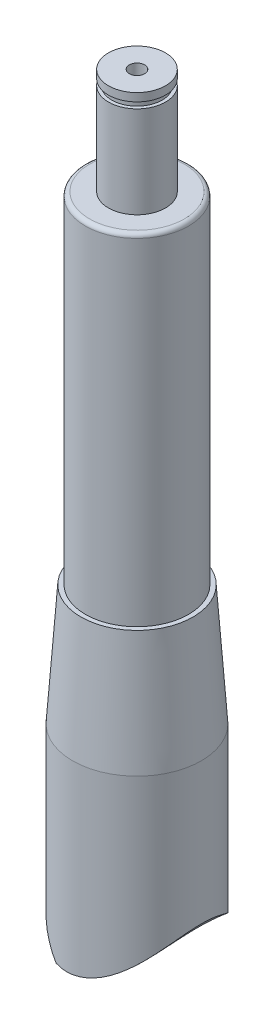
from build123d import *

# Parameters (mm, degrees)
FILLET1_R               = 1
CUT_EXTRUDE1_DEPTH      = 184.811724327
CUT_EXTRUDE1_DEPTH_BACK = 184.811724327
CUT_EXTRUDE2_DEPTH      = 183.746332302
CUT_EXTRUDE2_DEPTH_BACK = 180
SKETCH3_R               = 1.85
CUT_EXTRUDE3_DEPTH      = 184.811724344
CUT_EXTRUDE3_DEPTH_BACK = 184.811724344
SKETCH4_R               = 16


with BuildPart() as part:
    # Sketch1 → Revolve2 (revolve)
    with BuildSketch(Plane.XY):
        Polygon((0, 0), (15.5, 0), (15.5, 46), (13.5, 75), (12.425, 75), (12.425, 157), (6.875, 157), (6.875, 179.1), (6.070935316, 179.1), (6.070935316, 180.55), (6.870935316, 180.55), (6.870935316, 182.5), (0, 182.5), align=None)
    revolve(axis=Axis((0, 263.878189578, 0), (0, -1, 0)))

    # Fillet1
    fillet1_edges = [part.edges().sort_by_distance(p)[0] for p in [
        (-12.425, 157, 0),
    ]]
    fillet(fillet1_edges, radius=FILLET1_R)

    # Sketch2 → Cut-Extrude1 (cut, two sides: drawn at the far end of the back side and taken through both)
    with BuildSketch(Plane.XY.offset(-CUT_EXTRUDE1_DEPTH_BACK)):
        with BuildLine():
            Line((-15.5, 3), (-19.676433944, 0))
            Line((-19.676433944, 0), (9.520360954, -11.635719705))
            Line((9.520360954, -11.635719705), (20.15271979, -0.609569802))
            Line((20.15271979, -0.609569802), (15.5, 12))
            add(Edge.make_bspline(
                [(15.5, 12), (5.345045333, -3.515489974), (-15.5, 3)],
                knots=[0, 0, 0, 1, 1, 1], degree=2))
        make_face()
    extrude(amount=CUT_EXTRUDE1_DEPTH + CUT_EXTRUDE1_DEPTH_BACK, mode=Mode.SUBTRACT)

    # Sketch3 → Cut-Extrude2 (cut, two sides: drawn at the far end of the back side and taken through both)
    with BuildSketch(Plane(origin=(0, 182.5, 0), x_dir=(1, 0, 0), z_dir=(0, 1, 0)).offset(-CUT_EXTRUDE2_DEPTH_BACK)):
        Circle(SKETCH3_R)
    extrude(amount=CUT_EXTRUDE2_DEPTH + CUT_EXTRUDE2_DEPTH_BACK, mode=Mode.SUBTRACT)

    # Sketch4 → Cut-Extrude3 (cut, two sides: drawn at the far end of the back side and taken through both)
    with BuildSketch(Plane(origin=(0, 0, 0), x_dir=(0, 0, -1), z_dir=(1, 0, 0)).offset(-CUT_EXTRUDE3_DEPTH_BACK)):
        with Locations((0, -5.093252724)):
            Circle(SKETCH4_R)
    extrude(amount=CUT_EXTRUDE3_DEPTH + CUT_EXTRUDE3_DEPTH_BACK, mode=Mode.SUBTRACT)


solid = part.part
